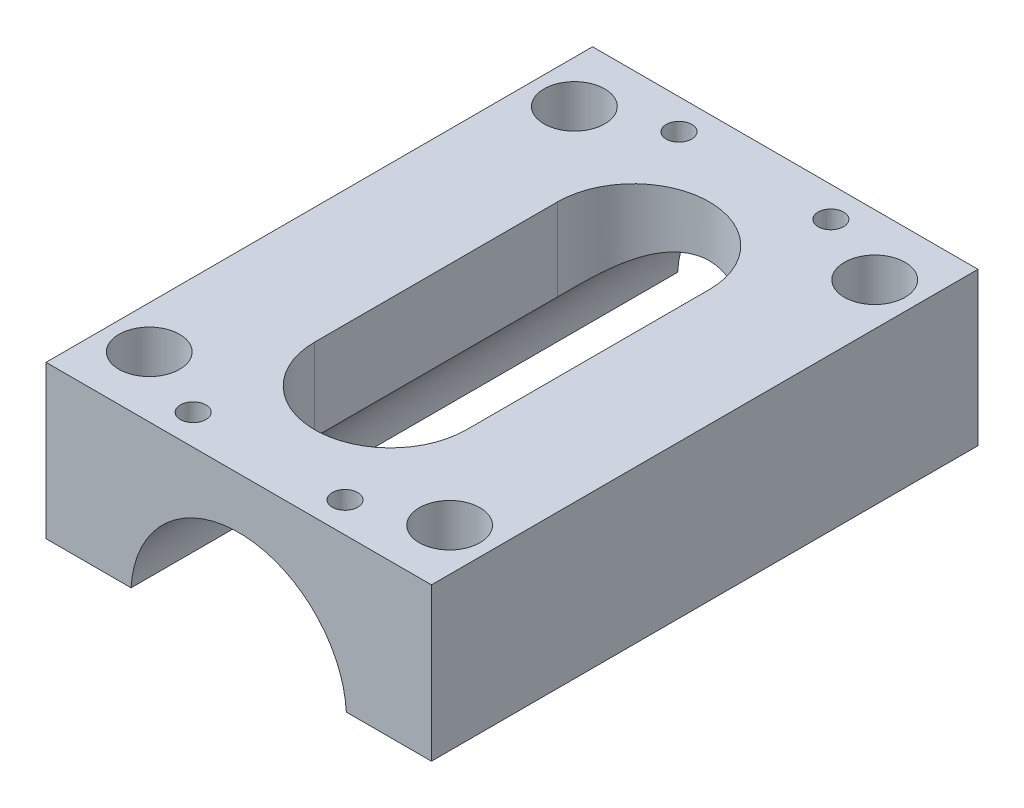
from build123d import *

# Parameters (mm, degrees)
BOSS_EXTRUDE1_DEPTH             = 90
BOSS_EXTRUDE2_START             = -90
BOSS_EXTRUDE2_DEPTH             = 90
F_5_0MM_CLEARANCE_DOWEL_HOLE1_D = 5
CUT_EXTRUDE1_REACH              = 101.384
SKETCH4_R                       = 5
CUT_EXTRUDE3_DEPTH              = 101.573977748
CUT_EXTRUDE4_REACH              = 100.691
TAP_DRILL_FOR_M5X0_8_TAP1_D     = 4.2
TAP_DRILL_FOR_M5X0_8_TAP1_DEPTH = 8
TAP_DRILL_FOR_M5X0_8_TAP1_TIP   = 1.2618073


with BuildPart() as part:
    # Sketch1 → Boss-Extrude1 (new body)
    with BuildSketch(Plane.XY):
        with BuildLine():
            Line((-31.734248061, 1), (-17.721808598, 1))
            ThreePointArc((-17.721808598, 1), (0, 17.75), (17.721808598, 1))
            Line((17.721808598, 1), (31.734248061, 1))
            ThreePointArc((31.734248061, 1), (0, 31.75), (-31.734248061, 1))
        make_face()
    extrude(amount=BOSS_EXTRUDE1_DEPTH)

    # Sketch12 → Boss-Extrude2 (add)
    with BuildSketch(Plane.XY.offset(90).offset(BOSS_EXTRUDE2_START)):
        with BuildLine():
            Line((31.734248061, 31.75), (0, 31.75))
            ThreePointArc((0, 31.75), (22.094258304, 22.801452805), (31.734248061, 1))
            Line((31.734248061, 1), (31.734248061, 31.75))
        make_face()
        with BuildLine():
            Line((-31.734248061, 31.75), (-31.734248061, 1))
            ThreePointArc((-31.734248061, 1), (-22.094258304, 22.801452805), (0, 31.75))
            Line((0, 31.75), (-31.734248061, 31.75))
        make_face()
    extrude(amount=BOSS_EXTRUDE2_DEPTH)

    # Ø5.0mm Clearance Dowel Hole1 (through all)
    with Locations(Plane(origin=(-24.72802833, 1, 80), x_dir=(0, 0, -1), z_dir=(0, -1, 0))):
        with Locations((0, 0), (70, 0), (0, 49.45605666), (70, 49.45605666)):
            Hole(F_5_0MM_CLEARANCE_DOWEL_HOLE1_D / 2)

    # Sketch4 → Cut-Extrude1 (cut, up to next)
    with BuildSketch(Plane(origin=(0, 4, 0), x_dir=(-1, 0, 0), z_dir=(0, -1, 0)), mode=Mode.PRIVATE) as cut_extrude1_sk1:
        with Locations(Location((24.72802833, -80, 0), (0, 0, 90))):
            Circle(SKETCH4_R)
    cut_extrude1_tool1 = extrude(cut_extrude1_sk1.sketch, amount=-CUT_EXTRUDE1_REACH, mode=Mode.PRIVATE) & part.part
    # Sketch4 → Cut-Extrude1 (cut, up to next)
    with BuildSketch(Plane(origin=(0, 4, 0), x_dir=(-1, 0, 0), z_dir=(0, -1, 0)), mode=Mode.PRIVATE) as cut_extrude1_sk2:
        with Locations(Location((24.72802833, -10, 0), (0, 0, 90))):
            Circle(SKETCH4_R)
    cut_extrude1_tool2 = extrude(cut_extrude1_sk2.sketch, amount=-CUT_EXTRUDE1_REACH, mode=Mode.PRIVATE) & part.part
    # Sketch4 → Cut-Extrude1 (cut, up to next)
    with BuildSketch(Plane(origin=(0, 4, 0), x_dir=(-1, 0, 0), z_dir=(0, -1, 0)), mode=Mode.PRIVATE) as cut_extrude1_sk3:
        with Locations(Location((-24.72802833, -10, 0), (0, 0, 90))):
            Circle(SKETCH4_R)
    cut_extrude1_tool3 = extrude(cut_extrude1_sk3.sketch, amount=-CUT_EXTRUDE1_REACH, mode=Mode.PRIVATE) & part.part
    # Sketch4 → Cut-Extrude1 (cut, up to next)
    with BuildSketch(Plane(origin=(0, 4, 0), x_dir=(-1, 0, 0), z_dir=(0, -1, 0)), mode=Mode.PRIVATE) as cut_extrude1_sk4:
        with Locations(Location((-24.72802833, -80, 0), (0, 0, 90))):
            Circle(SKETCH4_R)
    cut_extrude1_tool4 = extrude(cut_extrude1_sk4.sketch, amount=-CUT_EXTRUDE1_REACH, mode=Mode.PRIVATE) & part.part
    add(cut_extrude1_tool1.solids().sort_by_distance((-24.728028, 4, 80))[0], mode=Mode.SUBTRACT)
    add(cut_extrude1_tool2.solids().sort_by_distance((-24.728028, 4, 10))[0], mode=Mode.SUBTRACT)
    add(cut_extrude1_tool3.solids().sort_by_distance((24.728028, 4, 10))[0], mode=Mode.SUBTRACT)
    add(cut_extrude1_tool4.solids().sort_by_distance((24.728028, 4, 80))[0], mode=Mode.SUBTRACT)

    # Sketch8 → Cut-Extrude3 (cut, through all)
    with BuildSketch(Plane.XY.offset(90)):
        with BuildLine():
            Line((-31.734248061, 26.154588508), (-18, 26.154588508))
            ThreePointArc((-18, 26.154588508), (-9.424816043, 30.318894151), (0, 31.75))
            Line((0, 31.75), (-31.734248061, 31.75))
            Line((-31.734248061, 31.75), (-31.734248061, 26.154588508))
        make_face()
        with BuildLine():
            Line((18, 26.154588508), (-18, 26.154588508))
            ThreePointArc((-18, 26.154588508), (0, 31.75), (18, 26.154588508))
        make_face()
        with BuildLine():
            ThreePointArc((0, 31.75), (9.424816043, 30.318894151), (18, 26.154588508))
            Line((18, 26.154588508), (31.734248061, 26.154588508))
            Line((31.734248061, 26.154588508), (31.734248061, 31.75))
            Line((31.734248061, 31.75), (0, 31.75))
        make_face()
    extrude(amount=-CUT_EXTRUDE3_DEPTH, mode=Mode.SUBTRACT)

    # Sketch9 → Cut-Extrude4 (cut, up to next)
    with BuildSketch(Plane.XZ.offset(-1), mode=Mode.PRIVATE) as cut_extrude4_sk1:
        with BuildLine():
            Line((-12.5, 25), (-12.5, 65))
            ThreePointArc((-12.5, 65), (0, 77.5), (12.5, 65))
            Line((12.5, 65), (12.5, 25))
            ThreePointArc((12.5, 25), (0, 12.5), (-12.5, 25))
        make_face()
    cut_extrude4_tool1 = extrude(cut_extrude4_sk1.sketch, amount=-CUT_EXTRUDE4_REACH, mode=Mode.PRIVATE) & part.part
    add(cut_extrude4_tool1.solids().sort_by_distance((0, 1, 45))[0], mode=Mode.SUBTRACT)

    # Tap Drill for M5x0.8 Tap1
    with Locations(Plane(origin=(-12.5, 26.154588508, 5), x_dir=(0, 0, 1), z_dir=(0, 1, 0))):
        with Locations((0, 0), (0, 25), (80, 25), (80, 0)):
            Hole(TAP_DRILL_FOR_M5X0_8_TAP1_D / 2, depth=TAP_DRILL_FOR_M5X0_8_TAP1_DEPTH)
            with Locations((0, 0, -(TAP_DRILL_FOR_M5X0_8_TAP1_DEPTH + TAP_DRILL_FOR_M5X0_8_TAP1_TIP / 2))):  # 118° drill point
                Cone(0, TAP_DRILL_FOR_M5X0_8_TAP1_D / 2, TAP_DRILL_FOR_M5X0_8_TAP1_TIP, mode=Mode.SUBTRACT)


solid = part.part
